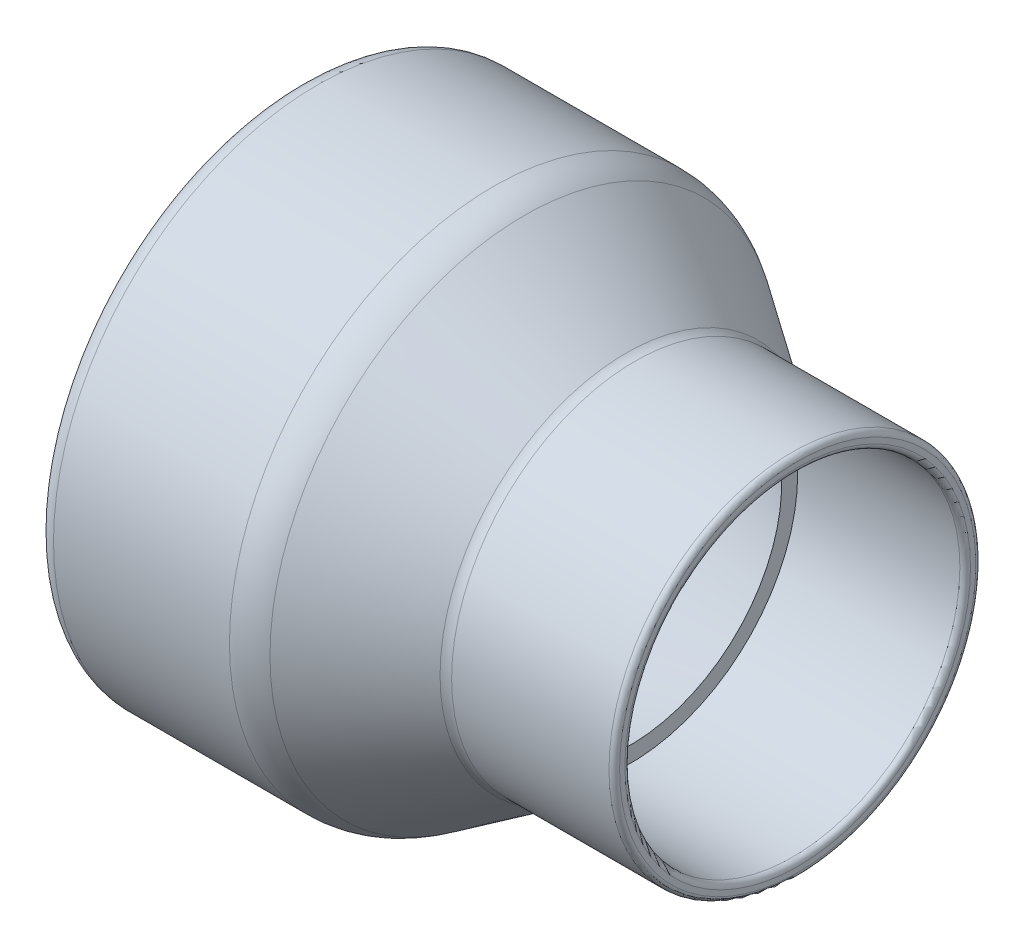
from build123d import *


with BuildPart() as part:
    # Эскиз1 → Повернуть1 (revolve)
    with BuildSketch(Plane.XY):
        with BuildLine():
            Line((-29.76, 29.333333333), (-29.76, 27.166666667))
            ThreePointArc((-29.76, 27.166666667), (-29.125398026, 25.634601974), (-27.593333333, 25))
            Line((-27.593333333, 25), (-5.193333333, 25))
            ThreePointArc((-5.193333333, 25), (-4.745499039, 24.814500961), (-4.56, 24.366666667))
            Line((-4.56, 24.366666667), (-4.56, 23.1))
            Line((-4.56, 23.1), (9.76, 18.1))
            Line((9.76, 18.1), (9.76, 20))
            Line((9.76, 20), (29.126666667, 20))
            ThreePointArc((29.126666667, 20), (29.574500961, 20.185499039), (29.76, 20.633333333))
            Line((29.76, 20.633333333), (29.76, 21.266666667))
            ThreePointArc((29.76, 21.266666667), (29.574500961, 21.714500961), (29.126666667, 21.9))
            Line((29.126666667, 21.9), (10.337944219, 21.9))
            ThreePointArc((10.337944219, 21.9), (9.785014419, 21.982235264), (9.279948122, 22.221822488))
            Line((9.279948122, 22.221822488), (-2.875607444, 30.370798287))
            ThreePointArc((-2.875607444, 30.370798287), (-4.64776989, 31.211455215), (-6.587874452, 31.5))
            Line((-6.587874452, 31.5), (-27.593333333, 31.5))
            ThreePointArc((-27.593333333, 31.5), (-29.125398026, 30.865398026), (-29.76, 29.333333333))
        make_face()
    revolve(axis=Axis((-29.76, 0, 0), (1, 0, 0)))


solid = part.part
